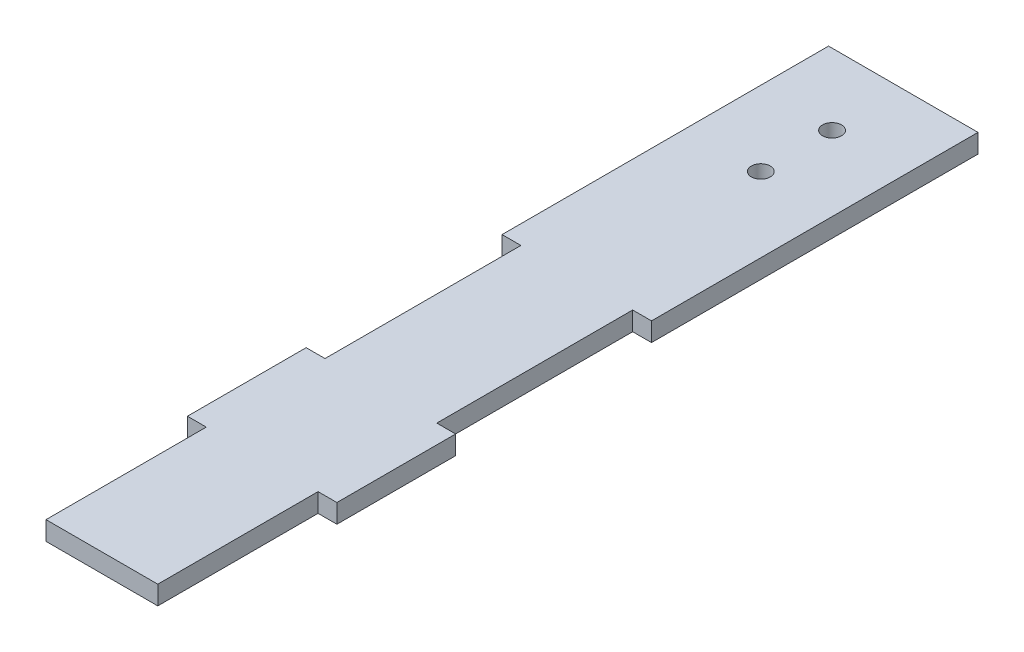
from build123d import *

# Parameters (mm, degrees)
BOSS_EXTRUDE1_DEPTH     = 3.175
CUT_EXTRUDE1_DEPTH      = 136.62296533
CUT_EXTRUDE1_DEPTH_BACK = 136.62296533
SKETCH2_R               = 1.6


with BuildPart() as part:
    # Sketch1 → Boss-Extrude1 (new body)
    with BuildSketch(Plane(origin=(0, 0, 0), x_dir=(1, 0, 0), z_dir=(0, 1, 0))):
        Polygon((-12.5875, 0), (12.5875, 0), (12.5875, -55), (9.415, -55), (9.415, -88), (12.59, -88), (12.59, -108), (9.415, -108), (9.415, -135), (-9.415, -135), (-9.415, -108), (-12.59, -108), (-12.59, -88), (-9.415, -88), (-9.415, -55), (-12.5875, -55), align=None)
    extrude(amount=BOSS_EXTRUDE1_DEPTH)

    # Sketch2 → Cut-Extrude1 (cut, two sides: drawn at the far end of the back side and taken through both)
    with BuildSketch(Plane(origin=(0, 3.175, 0), x_dir=(1, 0, 0), z_dir=(0, 1, 0)).offset(-CUT_EXTRUDE1_DEPTH_BACK)):
        with Locations(Location((0, -24, 0), (0, 0, 270))):
            Circle(SKETCH2_R)
        with Locations(Location((0, -12, 0), (0, 0, 270))):
            Circle(SKETCH2_R)
    extrude(amount=CUT_EXTRUDE1_DEPTH + CUT_EXTRUDE1_DEPTH_BACK, mode=Mode.SUBTRACT)


solid = part.part
